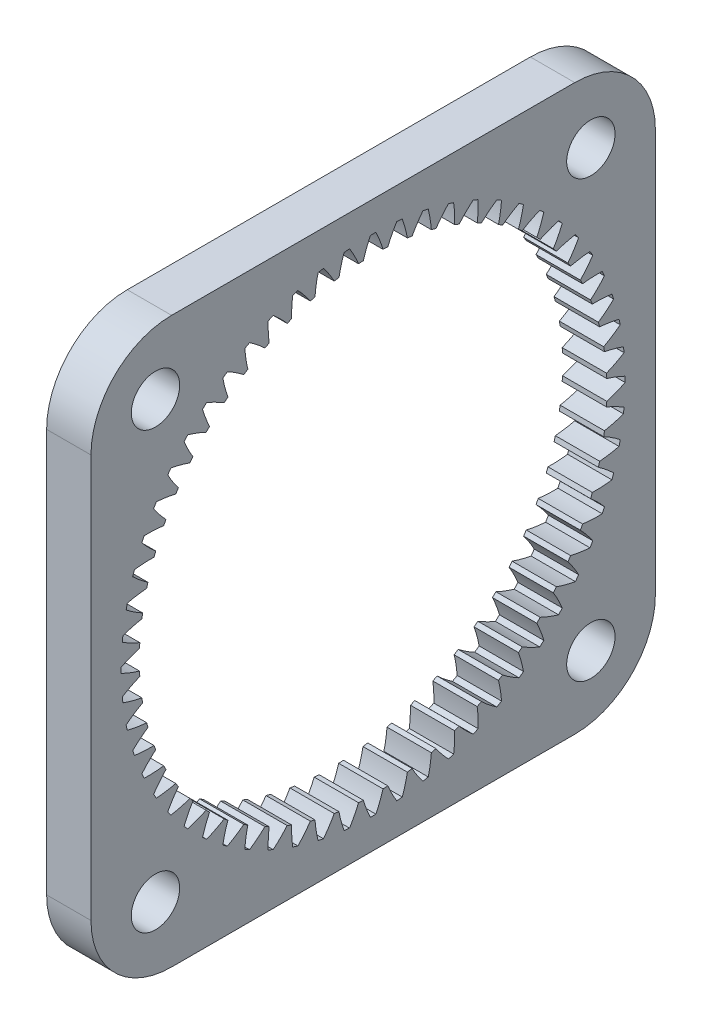
from build123d import *

# Parameters (mm, degrees)
BASPROSKE_W             = 5.5
BASPROSKE_H             = 6
TOOTHCUT_DEPTH          = 50.802108389
TEETHCUTS_COUNT         = 60
TEETHCUTS_ANGLE         = 354
SALIENTE_EXTRUIR1_DEPTH = 5.5
REDONDEO1_R             = 10
CROQUIS3_R              = 3
CORTAR_EXTRUIR1_DEPTH   = 6


with BuildPart() as part:
    # BasProSke → Base-Revolve (revolve)
    with BuildSketch(Plane(origin=(0, 0, 0), x_dir=(1, 0, 0), z_dir=(0, 1, 0)), mode=Mode.PRIVATE) as base_revolve_sk:
        with Locations((2.75, 32)):
            Rectangle(BASPROSKE_W, BASPROSKE_H)
    revolve(base_revolve_sk.sketch.rotate(Axis((-10, 0, 0), (1, 0, 0)), 180), axis=Axis((-10, 0, 0), (1, 0, 0)))

    # TooCutSke → ToothCut (cut, through all)
    with BuildSketch(Plane(origin=(0, 0, 0), x_dir=(0, 0, -1), z_dir=(1, 0, 0))):
        with BuildLine():
            ThreePointArc((1.227357706, 28.948593027), (0.830805794, 30.117149174), (0.339543276, 31.24915537))
            ThreePointArc((0.339543276, 31.24915537), (0, 31.251), (-0.339543276, 31.24915537))
            ThreePointArc((-0.339543276, 31.24915537), (-0.830805794, 30.117149174), (-1.227357706, 28.948593027))
            ThreePointArc((-1.227357706, 28.948593027), (0, 28.9746), (1.227357706, 28.948593027))
        make_face()
    toothcut = extrude(amount=TOOTHCUT_DEPTH, mode=Mode.SUBTRACT)

    # TeethCuts: ToothCut ×60 about axis
    teethcuts_axis = Axis((-10, 0, 0), (1, 0, 0))
    for i in range(1, TEETHCUTS_COUNT):
        add(toothcut.rotate(teethcuts_axis, i * TEETHCUTS_ANGLE / (TEETHCUTS_COUNT - 1)), mode=Mode.SUBTRACT)

    # Croquis1 → Saliente-Extruir1 (add, through all)
    with BuildSketch(Plane(origin=(5.5, 0, 0), x_dir=(0, 0, -1), z_dir=(1, 0, 0))):
        with BuildLine():
            Line((1.1e-08, 35), (-35, 35))
            Line((-35, 35), (-35, -1.47e-07))
            ThreePointArc((-35, -1.47e-07), (-24.74873739, 24.748737293), (1.1e-08, 35))
        make_face()
        with BuildLine():
            Line((35, 35), (1.1e-08, 35))
            ThreePointArc((1.1e-08, 35), (24.748737345, 24.748737338), (35, 0))
            Line((35, 0), (35, 35))
        make_face()
        with BuildLine():
            Line((35, -35), (35, 0))
            ThreePointArc((35, 0), (24.748737335, -24.748737348), (-1.9e-08, -35))
            Line((-1.9e-08, -35), (35, -35))
        make_face()
        with BuildLine():
            ThreePointArc((-1.9e-08, -35), (-24.748737296, -24.748737387), (-35, -1.47e-07))
            Line((-35, -1.47e-07), (-35, -35))
            Line((-35, -35), (-1.9e-08, -35))
        make_face()
    extrude(amount=-SALIENTE_EXTRUIR1_DEPTH)

    # Redondeo1
    redondeo1_edges = [part.edges().sort_by_distance(p)[0] for p in [
        (2.75, 35, 35),
        (2.75, 35, -35),
        (2.75, -35, -35),
        (2.75, -35, 35),
    ]]
    fillet(redondeo1_edges, radius=REDONDEO1_R)

    # Croquis3 → Cortar-Extruir1 (cut)
    with BuildSketch(Plane(origin=(5.5, 0, 0), x_dir=(0, 0, -1), z_dir=(1, 0, 0))):
        with Locations((-27, 27)):
            Circle(CROQUIS3_R)
        with Locations((27, 27)):
            Circle(CROQUIS3_R)
        with Locations((-27, -27)):
            Circle(CROQUIS3_R)
        with Locations((27, -27)):
            Circle(CROQUIS3_R)
    extrude(amount=-CORTAR_EXTRUIR1_DEPTH, mode=Mode.SUBTRACT)


solid = part.part
